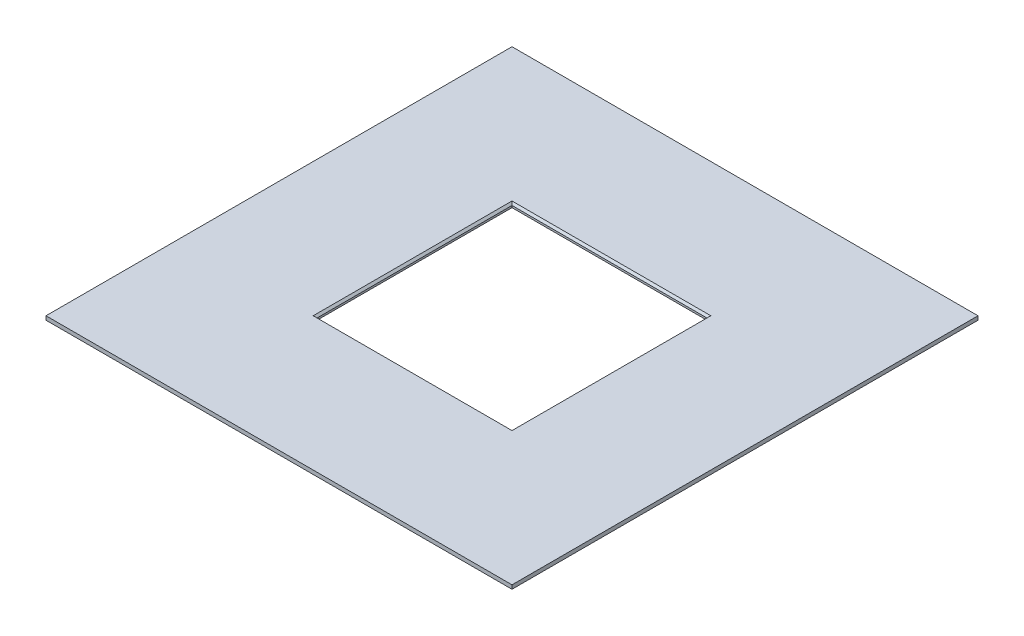
from build123d import *

# Parameters (mm, degrees)
SKETCH1_W           = 120
SKETCH1_H           = 120
SKETCH1_W_2         = 50.2
SKETCH1_H_2         = 50.2
BOSS_EXTRUDE1_DEPTH = 1
CHAMFER1_SIZE       = 0.5


with BuildPart() as part:
    # Sketch1 → Boss-Extrude1 (new body)
    with BuildSketch(Plane(origin=(0, 0, 0), x_dir=(1, 0, 0), z_dir=(0, 1, 0))):
        Rectangle(SKETCH1_W, SKETCH1_H)
        Rectangle(SKETCH1_W_2, SKETCH1_H_2, mode=Mode.SUBTRACT)
    extrude(amount=BOSS_EXTRUDE1_DEPTH)

    # Chamfer1
    chamfer1_edges = [part.edges().sort_by_distance(p)[0] for p in [
        (25.1, 1, 0),
        (0, 1, -25.1),
        (-25.1, 1, 0),
        (0, 1, 25.1),
    ]]
    chamfer(chamfer1_edges, length=CHAMFER1_SIZE)


solid = part.part
